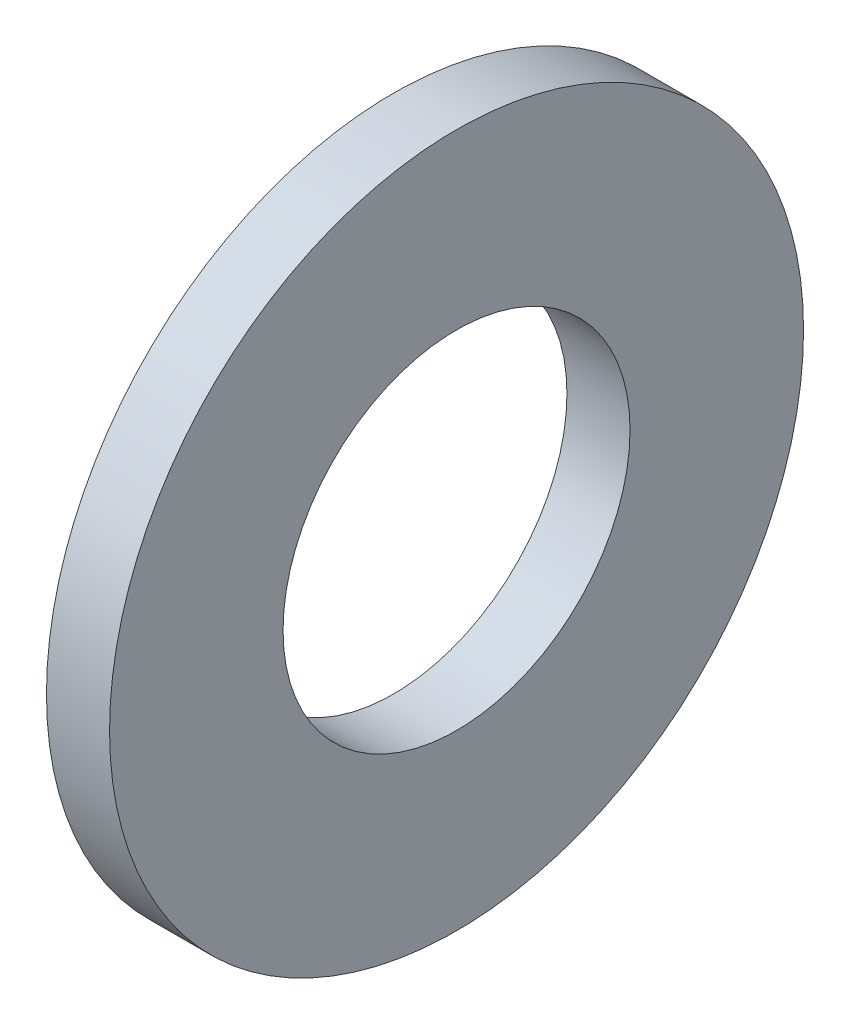
from build123d import *

# Parameters (mm, degrees)
SKETCH1_R          = 5.5
SKETCH1_R_2        = 2.75
BASE_EXTRUDE_DEPTH = 1


with BuildPart() as part:
    # Sketch1 → Base-Extrude (new body)
    with BuildSketch(Plane(origin=(0, 0, 0), x_dir=(0, 0, -1), z_dir=(1, 0, 0))):
        Circle(SKETCH1_R)
        Circle(SKETCH1_R_2, mode=Mode.SUBTRACT)
    extrude(amount=BASE_EXTRUDE_DEPTH)


solid = part.part
